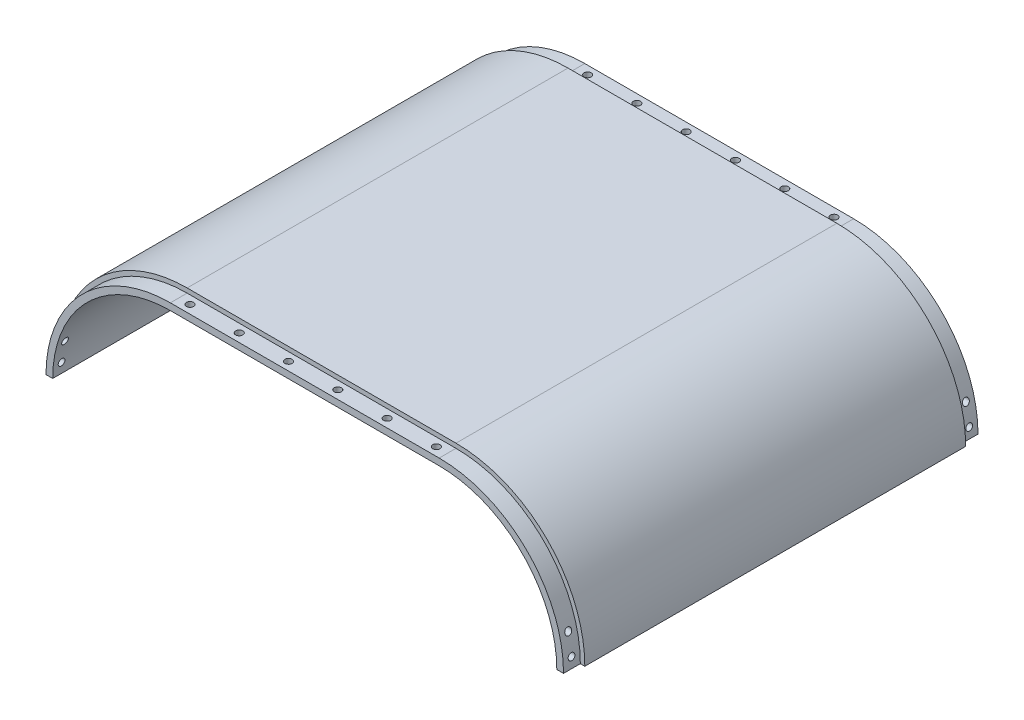
from build123d import *

# Parameters (mm, degrees)
BOSS_EXTRUDE1_DEPTH = 92.5
SKETCH2_R           = 1.5
CUT_EXTRUDE1_DEPTH  = 161.2146997
SKETCH4_R           = 1.6
CUT_EXTRUDE2_DEPTH  = 161.214699867
CUT_EXTRUDE3_DEPTH  = 7.5


with BuildPart() as part:
    # Sketch1 → Boss-Extrude1 (new, symmetric)
    with BuildSketch(Plane.XY):
        with BuildLine():
            ThreePointArc((117.5, 0), (100.658639918, 40.658639918), (60, 57.5))
            Line((60, 57.5), (-60, 57.5))
            ThreePointArc((-60, 57.5), (-100.658639918, 40.658639918), (-117.5, 0))
            Line((-117.5, 0), (-112.5, 0))
            ThreePointArc((-112.5, 0), (-112.485698596, 1.22533379), (-112.442802175, 2.45))
            ThreePointArc((-112.442802175, 2.45), (-112.306489538, 4.503460029), (-112.089802265, 6.55))
            ThreePointArc((-112.089802265, 6.55), (-111.721057974, 9.010114432), (-111.236193262, 11.45))
            ThreePointArc((-111.236193262, 11.45), (-110.731665892, 13.511035335), (-110.144266871, 15.55))
            ThreePointArc((-110.144266871, 15.55), (-91.143819612, 42.264790311), (-60, 52.5))
            Line((-60, 52.5), (-57.05, 52.5))
            Line((-57.05, 52.5), (-52.95, 52.5))
            Line((-52.95, 52.5), (-35.05, 52.5))
            Line((-35.05, 52.5), (-30.95, 52.5))
            Line((-30.95, 52.5), (-13.05, 52.5))
            Line((-13.05, 52.5), (-8.95, 52.5))
            Line((-8.95, 52.5), (8.95, 52.5))
            Line((8.95, 52.5), (13.05, 52.5))
            Line((13.05, 52.5), (30.95, 52.5))
            Line((30.95, 52.5), (35.05, 52.5))
            Line((35.05, 52.5), (52.95, 52.5))
            Line((52.95, 52.5), (57.05, 52.5))
            Line((57.05, 52.5), (60, 52.5))
            ThreePointArc((60, 52.5), (91.143819612, 42.264790311), (110.144266871, 15.55))
            ThreePointArc((110.144266871, 15.55), (110.731665892, 13.511035335), (111.236193262, 11.45))
            ThreePointArc((111.236193262, 11.45), (111.721057974, 9.010114432), (112.089802265, 6.55))
            ThreePointArc((112.089802265, 6.55), (112.306489538, 4.503460029), (112.442802175, 2.45))
            ThreePointArc((112.442802175, 2.45), (112.485698596, 1.22533379), (112.5, 0))
            Line((112.5, 0), (117.5, 0))
        make_face()
    extrude(amount=BOSS_EXTRUDE1_DEPTH, both=True)

    # Sketch2 → Cut-Extrude1 (cut, symmetric)
    with BuildSketch(Plane(origin=(0, 0, 0), x_dir=(0, 0, -1), z_dir=(1, 0, 0))):
        with Locations((-88.75, 4.5)):
            Circle(SKETCH2_R)
        with Locations((-88.75, 13.5)):
            Circle(SKETCH2_R)
    cut_extrude1 = extrude(amount=CUT_EXTRUDE1_DEPTH, both=True, mode=Mode.SUBTRACT)

    # Sketch4 → Cut-Extrude2 (cut, symmetric)
    with BuildSketch(Plane(origin=(0, 57.5, 0), x_dir=(1, 0, 0), z_dir=(0, 1, 0))):
        with Locations(Location((-55, -88.75, 0), (0, 0, 270))):
            Circle(SKETCH4_R)
        with Locations(Location((-33, -88.75, 0), (0, 0, 270))):
            Circle(SKETCH4_R)
        with Locations(Location((-11, -88.75, 0), (0, 0, 270))):
            Circle(SKETCH4_R)
        with Locations(Location((11, -88.75, 0), (0, 0, 270))):
            Circle(SKETCH4_R)
        with Locations(Location((33, -88.75, 0), (0, 0, 270))):
            Circle(SKETCH4_R)
        with Locations(Location((55, -88.75, 0), (0, 0, 270))):
            Circle(SKETCH4_R)
    cut_extrude2 = extrude(amount=CUT_EXTRUDE2_DEPTH, both=True, mode=Mode.SUBTRACT)

    # Sketch5 → Cut-Extrude3 (cut)
    with BuildSketch(Plane(origin=(0, 0, -92.5), x_dir=(-1, 0, 0), z_dir=(0, 0, -1))):
        with BuildLine():
            Line((115.5, 0), (117.5, 0))
            ThreePointArc((117.5, 0), (100.658639918, 40.658639918), (60, 57.5))
            Line((60, 57.5), (-60, 57.5))
            ThreePointArc((-60, 57.5), (-100.658639918, 40.658639918), (-117.5, 0))
            Line((-117.5, 0), (-115.5, 0))
            ThreePointArc((-115.5, 0), (-99.244426356, 39.244426356), (-60, 55.5))
            Line((-60, 55.5), (60, 55.5))
            ThreePointArc((60, 55.5), (99.244426356, 39.244426356), (115.5, 0))
        make_face()
    cut_extrude3 = extrude(amount=-CUT_EXTRUDE3_DEPTH, mode=Mode.SUBTRACT)

    # Mirror1: Cut-Extrude1, Cut-Extrude2, Cut-Extrude3 across plane
    add(cut_extrude1.mirror(Plane.XY), mode=Mode.SUBTRACT)
    add(cut_extrude2.mirror(Plane.XY), mode=Mode.SUBTRACT)
    add(cut_extrude3.mirror(Plane.XY), mode=Mode.SUBTRACT)


solid = part.part
